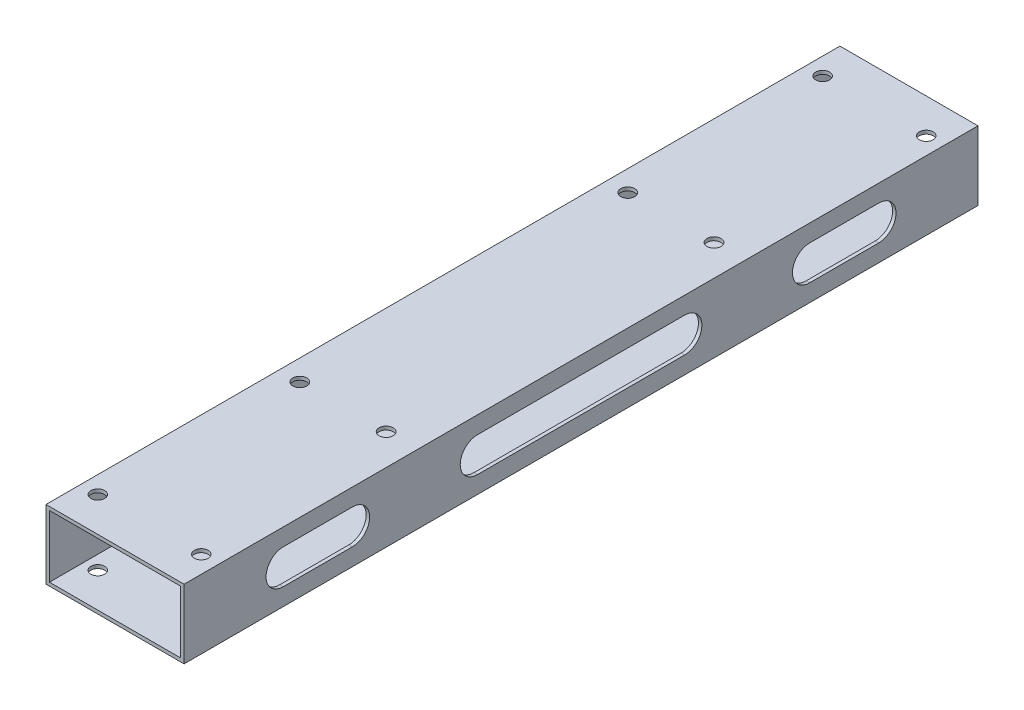
from build123d import *

# Parameters (mm, degrees)
SKETCH_1_W          = 40
SKETCH_1_H          = 20
SKETCH_1_W_2        = 38
SKETCH_1_H_2        = 18
EXTRUDE_1_DEPTH     = 115
SKETCH_2_R          = 2
CUT_EXTRUDE_1_DEPTH = 115
SKETCH_3_R          = 2.025
CUT_EXTRUDE_2_DEPTH = 35
CUT_EXTRUDE_3_DEPTH = 129.5
CUT_EXTRUDE_4_DEPTH = 129.5


with BuildPart() as part:
    # 草图1 → 凸台-拉伸1 (new, symmetric)
    with BuildSketch(Plane.XY):
        Rectangle(SKETCH_1_W, SKETCH_1_H)
        Rectangle(SKETCH_1_W_2, SKETCH_1_H_2, mode=Mode.SUBTRACT)
    extrude(amount=EXTRUDE_1_DEPTH, both=True)

    # 草图2 → 切除-拉伸1 (cut, symmetric)
    with BuildSketch(Plane(origin=(0, 10, 0), x_dir=(1, 0, 0), z_dir=(0, 1, 0))):
        with Locations((-15, 105)):
            Circle(SKETCH_2_R)
        with Locations((15, 105)):
            Circle(SKETCH_2_R)
    cut_extrude_1 = extrude(amount=CUT_EXTRUDE_1_DEPTH, both=True, mode=Mode.SUBTRACT)

    # 镜向1: 切除-拉伸1 across plane
    add(cut_extrude_1.mirror(Plane.XY), mode=Mode.SUBTRACT)

    # 草图3 → 切除-拉伸2 (cut, symmetric)
    with BuildSketch(Plane.XZ.offset(10)):
        with Locations(Location((-13.975679885, -47.500000831, 0), (0, 0, 270))):
            Circle(SKETCH_3_R)
        with Locations(Location((11.024320115, -47.500000831, 0), (0, 0, 270))):
            Circle(SKETCH_3_R)
        with Locations(Location((-13.975679885, 47.499999169, 0), (0, 0, 270))):
            Circle(SKETCH_3_R)
        with Locations(Location((11.024320115, 47.499999169, 0), (0, 0, 270))):
            Circle(SKETCH_3_R)
    extrude(amount=CUT_EXTRUDE_2_DEPTH, both=True, mode=Mode.SUBTRACT)

    # 草图4 → 切除-拉伸3 (cut, symmetric)
    with BuildSketch(Plane(origin=(20, 0, 0), x_dir=(0, 0, -1), z_dir=(1, 0, 0))):
        with BuildLine():
            Line((-30, 5), (30, 5))
            ThreePointArc((30, 5), (35, 0), (30, -5))
            Line((30, -5), (-30, -5))
            ThreePointArc((-30, -5), (-35, 0), (-30, 5))
        make_face()
    extrude(amount=CUT_EXTRUDE_3_DEPTH, both=True, mode=Mode.SUBTRACT)

    # 草图5 → 切除-拉伸4 (cut, symmetric)
    with BuildSketch(Plane(origin=(20, 0, 0), x_dir=(0, 0, -1), z_dir=(1, 0, 0))):
        with BuildLine():
            Line((-86.249999585, 5), (-66.249999585, 5))
            ThreePointArc((-66.249999585, 5), (-61.249999585, 0), (-66.249999585, -5))
            Line((-66.249999585, -5), (-86.249999585, -5))
            ThreePointArc((-86.249999585, -5), (-91.249999585, 0), (-86.249999585, 5))
        make_face()
    cut_extrude_4 = extrude(amount=CUT_EXTRUDE_4_DEPTH, both=True, mode=Mode.SUBTRACT)

    # 镜向2: 切除-拉伸4 across plane
    add(cut_extrude_4.mirror(Plane.XY), mode=Mode.SUBTRACT)


solid = part.part
